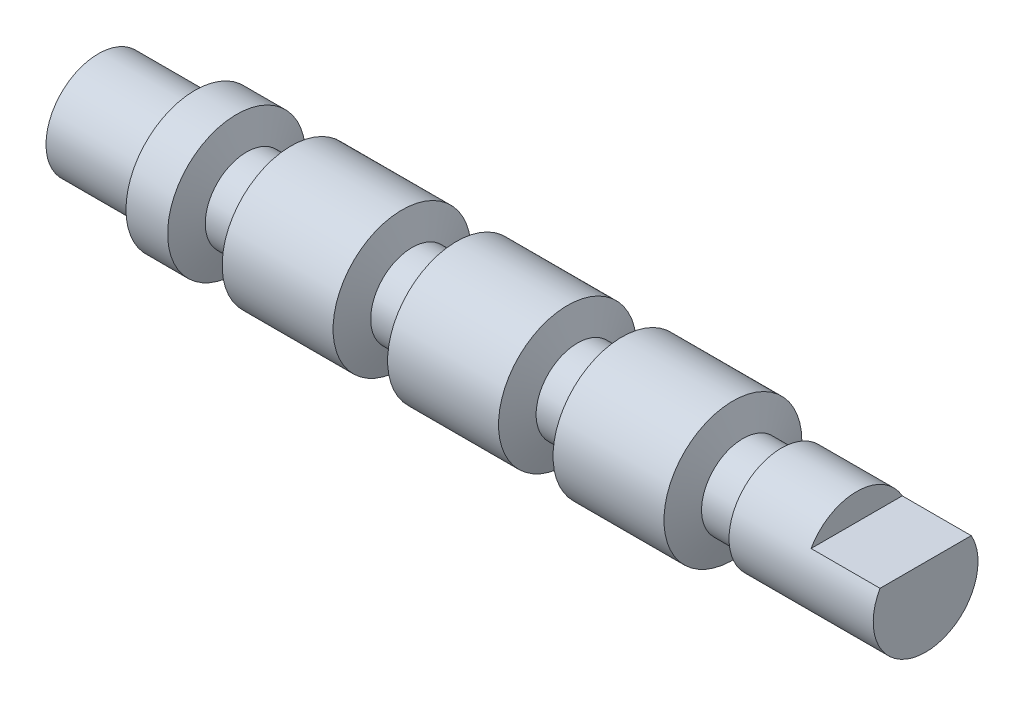
from build123d import *

# Parameters (mm, degrees)
CUT_EXTRUDE2_START = -7
SKETCH4_R          = 5
SKETCH4_R_2        = 3.8
CUT_EXTRUDE2_DEPTH = 7
SKETCH6_R          = 5
SKETCH6_R_2        = 3.8
CUT_EXTRUDE6_DEPTH = 12
CUT_EXTRUDE5_DEPTH = 5


with BuildPart() as part:
    # Sketch2 → Revolve1 (revolve)
    with BuildSketch(Plane(origin=(0, 0, 0), x_dir=(1, 0, 0), z_dir=(0, 1, 0))):
        Polygon((30, -5), (-30, -5), (-30, 0), (-19.977940469, 0), (-19.25, -2), (-16.75, -2), (-16.022059531, 0), (-7.977940469, 0), (-7.25, -2), (-4.75, -2), (-4.022059531, 0), (4.022059531, 0), (4.75, -2), (7.25, -2), (7.977940469, 0), (16.022059531, 0), (16.75, -2), (19.25, -2), (19.977940469, 0), (30, 0), align=None)
    revolve(axis=Axis((30, 0, 5), (-1, 0, 0)))

    # Sketch4 → Cut-Extrude2 (cut)
    with BuildSketch(Plane.ZY.offset(30).offset(CUT_EXTRUDE2_START)):
        with Locations(Location((5, 0, 0), (0, 0, 180))):
            Circle(SKETCH4_R)
        with Locations((5, 0)):
            Circle(SKETCH4_R_2, mode=Mode.SUBTRACT)
    extrude(amount=CUT_EXTRUDE2_DEPTH, mode=Mode.SUBTRACT)

    # Sketch6 → Cut-Extrude6 (cut)
    with BuildSketch(Plane(origin=(30, 0, 0), x_dir=(0, 0, -1), z_dir=(1, 0, 0))):
        with Locations((-5, 0)):
            Circle(SKETCH6_R)
        with Locations(Location((-5, 0, 0), (0, 0, 180))):
            Circle(SKETCH6_R_2, mode=Mode.SUBTRACT)
    extrude(amount=-CUT_EXTRUDE6_DEPTH, mode=Mode.SUBTRACT)

    # Sketch5 → Cut-Extrude5 (cut)
    with BuildSketch(Plane(origin=(30, 0, 0), x_dir=(0, 0, -1), z_dir=(1, 0, 0))):
        with BuildLine():
            Line((-8.307550461, 1.870858078), (-1.692449539, 1.870858078))
            ThreePointArc((-1.692449539, 1.870858078), (-5, 3.8), (-8.307550461, 1.870858078))
        make_face()
    extrude(amount=-CUT_EXTRUDE5_DEPTH, mode=Mode.SUBTRACT)


solid = part.part
